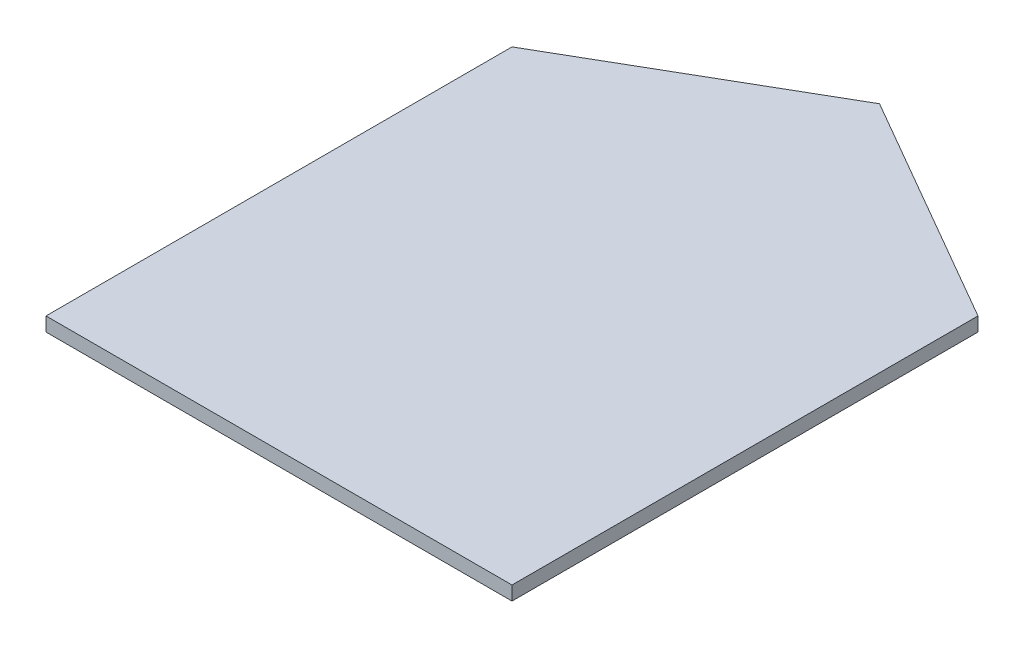
from build123d import *

# Parameters (mm, degrees)
BOSS_EXTRUDE1_DEPTH = 3


with BuildPart() as part:
    # Sketch2 → Boss-Extrude1 (new body)
    with BuildSketch(Plane(origin=(0, 0, 0), x_dir=(1, 0, 0), z_dir=(0, 1, 0))):
        Polygon((0, 0), (100, 0), (100, 100.000003541), (50, 128.867517), (0, 100.000003541), align=None)
    extrude(amount=BOSS_EXTRUDE1_DEPTH)


solid = part.part
